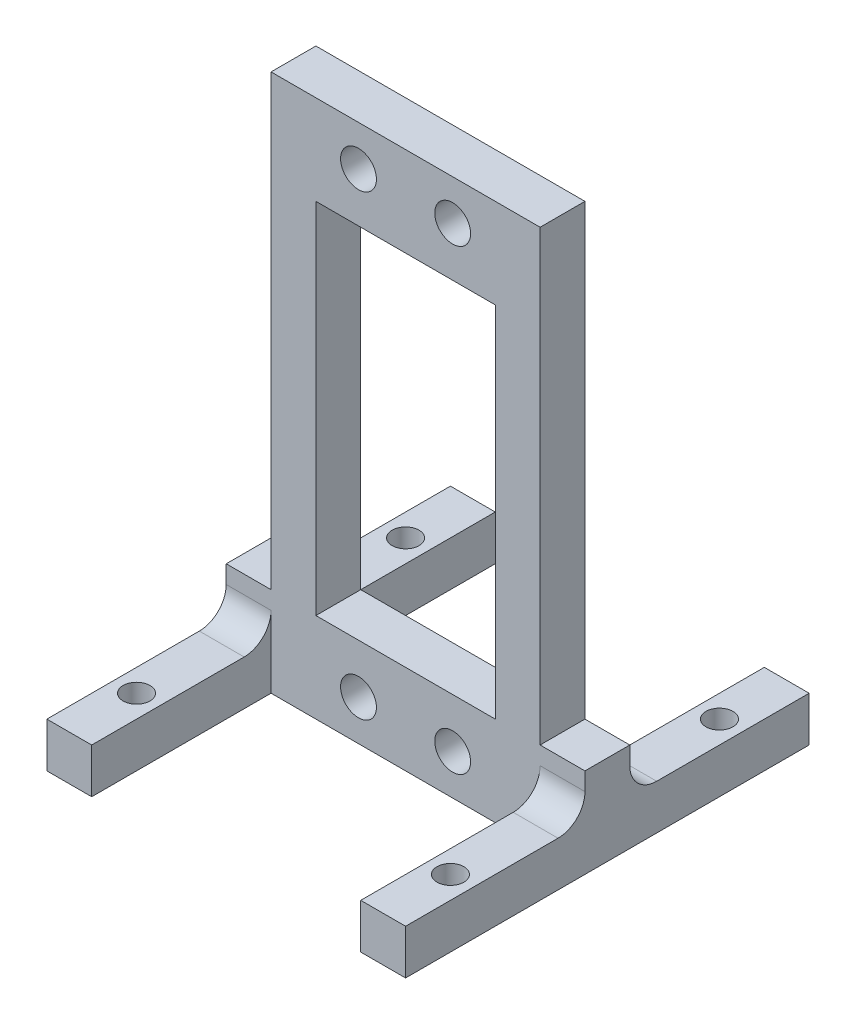
from build123d import *

# Parameters (mm, degrees)
SKETCH_2_W          = 30
SKETCH_2_H          = 60
SKETCH_2_W_2        = 20
SKETCH_2_H_2        = 40
EXTRUDE_1_DEPTH     = 5
SKETCH_3_R          = 2
CUT_EXTRUDE_1_DEPTH = 5
EXTRUDE_2_DEPTH     = 5
SKETCH_6_R          = 1.5
CUT_EXTRUDE_2_DEPTH = 5


with BuildPart() as part:
    # 草图2 → 凸台-拉伸1 (new body)
    with BuildSketch(Plane.XY):
        with Locations((10, -20)):
            Rectangle(SKETCH_2_W, SKETCH_2_H)
        with Locations((10, -20)):
            Rectangle(SKETCH_2_W_2, SKETCH_2_H_2, mode=Mode.SUBTRACT)
    extrude(amount=EXTRUDE_1_DEPTH)

    # 草图3 → 切除-拉伸1 (cut)
    with BuildSketch(Plane.XY.offset(5)):
        with Locations((15.25, 5.5)):
            Circle(SKETCH_3_R)
        with Locations((15.25, -45.5)):
            Circle(SKETCH_3_R)
        with Locations((4.75, -45.5)):
            Circle(SKETCH_3_R)
        with Locations((4.75, 5.5)):
            Circle(SKETCH_3_R)
    extrude(amount=-CUT_EXTRUDE_1_DEPTH, mode=Mode.SUBTRACT)

    # 草图5 → 凸台-拉伸2 (add)
    with BuildSketch(Plane(origin=(25, 0, 0), x_dir=(0, 0, -1), z_dir=(1, 0, 0))):
        with BuildLine():
            Line((-5, -42), (-5, -40))
            Line((-5, -40), (0, -40))
            Line((0, -40), (0, -42))
            ThreePointArc((0, -42), (0.878679656, -44.121320344), (3, -45))
            Line((3, -45), (20, -45))
            Line((20, -45), (20, -50))
            Line((20, -50), (0, -50))
            Line((0, -50), (-5, -50))
            Line((-5, -50), (-25, -50))
            Line((-25, -50), (-25, -45))
            Line((-25, -45), (-8, -45))
            ThreePointArc((-8, -45), (-5.878679656, -44.121320344), (-5, -42))
        make_face()
    extrude_2 = extrude(amount=EXTRUDE_2_DEPTH)

    # 镜向1: 凸台-拉伸2 across plane
    add(extrude_2.mirror(Plane(origin=(10, 0, 0), x_dir=(0, 0, 1), z_dir=(1, 0, 0))))

    # 草图6 → 切除-拉伸2 (cut)
    with BuildSketch(Plane(origin=(0, -45, 0), x_dir=(1, 0, 0), z_dir=(0, 1, 0))):
        with Locations(Location((-7.5, 12.5, 0), (0, 0, 270))):
            Circle(SKETCH_6_R)
        with Locations(Location((-7.5, -17.5, 0), (0, 0, 270))):
            Circle(SKETCH_6_R)
        with Locations(Location((27.5, -17.5, 0), (0, 0, 270))):
            Circle(SKETCH_6_R)
        with Locations(Location((27.5, 12.5, 0), (0, 0, 270))):
            Circle(SKETCH_6_R)
    extrude(amount=-CUT_EXTRUDE_2_DEPTH, mode=Mode.SUBTRACT)


solid = part.part
